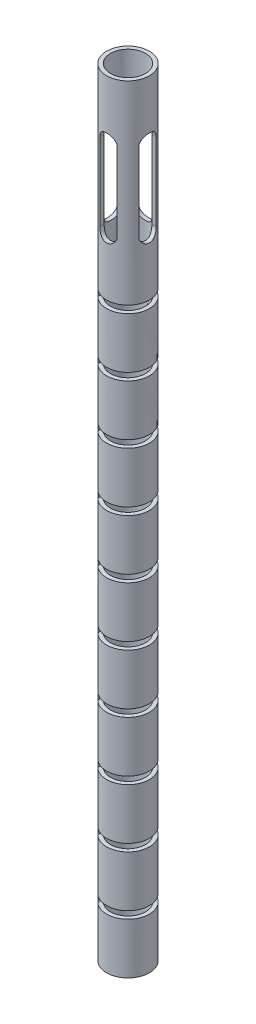
from build123d import *

# Parameters (mm, degrees)
SKETCH2_R           = 0.55
SKETCH2_R_2         = 0.45
BOSS_EXTRUDE1_DEPTH = 20
CUT_EXTRUDE1_START  = 1.5
CUT_EXTRUDE1_DEPTH  = 0.1901
LPATTERN2_COUNT     = 10
LPATTERN2_PITCH     = 1.5
CUT_EXTRUDE3_DEPTH  = 21.015119285
CIRPATTERN2_COUNT   = 4
FILLET2_R           = 0.02


with BuildPart() as part:
    # Sketch2 → Boss-Extrude1 (new body)
    with BuildSketch(Plane(origin=(0, 0, 0), x_dir=(1, 0, 0), z_dir=(0, 1, 0))):
        Circle(SKETCH2_R)
        Circle(SKETCH2_R_2, mode=Mode.SUBTRACT)
    extrude(amount=BOSS_EXTRUDE1_DEPTH)

    # Sketch3 → Cut-Extrude1 (cut)
    with BuildSketch(Plane(origin=(0, 0, 0), x_dir=(1, 0, 0), z_dir=(0, 1, 0)).offset(CUT_EXTRUDE1_START)):
        with BuildLine():
            Line((-0.385, -0.460190178), (-0.385, 0.460190178))
            ThreePointArc((-0.385, 0.460190178), (0.6, 0), (-0.385, -0.460190178))
        make_face()
    cut_extrude1 = extrude(amount=-CUT_EXTRUDE1_DEPTH, mode=Mode.SUBTRACT)

    # LPattern2: Cut-Extrude1 ×10
    with Locations(*[(0, i * LPATTERN2_PITCH, 0) for i in range(1, LPATTERN2_COUNT)]):
        add(cut_extrude1, mode=Mode.SUBTRACT)

    # Sketch5 → Cut-Extrude3 (cut, through all)
    with BuildSketch(Plane.XY):
        with BuildLine():
            Line((0.225, 18.5), (0.225, 16.5))
            ThreePointArc((0.225, 16.5), (0, 16.275), (-0.225, 16.5))
            Line((-0.225, 16.5), (-0.225, 18.5))
            ThreePointArc((-0.225, 18.5), (0, 18.725), (0.225, 18.5))
        make_face()
    cut_extrude3 = extrude(amount=-CUT_EXTRUDE3_DEPTH, mode=Mode.SUBTRACT)

    # CirPattern2: Cut-Extrude3 ×4 about axis
    cirpattern2_axis = Axis((0, 31.5, 0), (0, -1, 0))
    for i in range(1, CIRPATTERN2_COUNT):
        add(cut_extrude3.rotate(cirpattern2_axis, i * 360 / CIRPATTERN2_COUNT), mode=Mode.SUBTRACT)

    # Fillet2
    fillet2_edges = [part.edges().sort_by_distance(p)[0] for p in [
        (-0.385, 1.5, 0.312874259),
        (-0.385, 1.3099, 0.312874259),
    ]]
    fillet(fillet2_edges, radius=FILLET2_R)


solid = part.part
